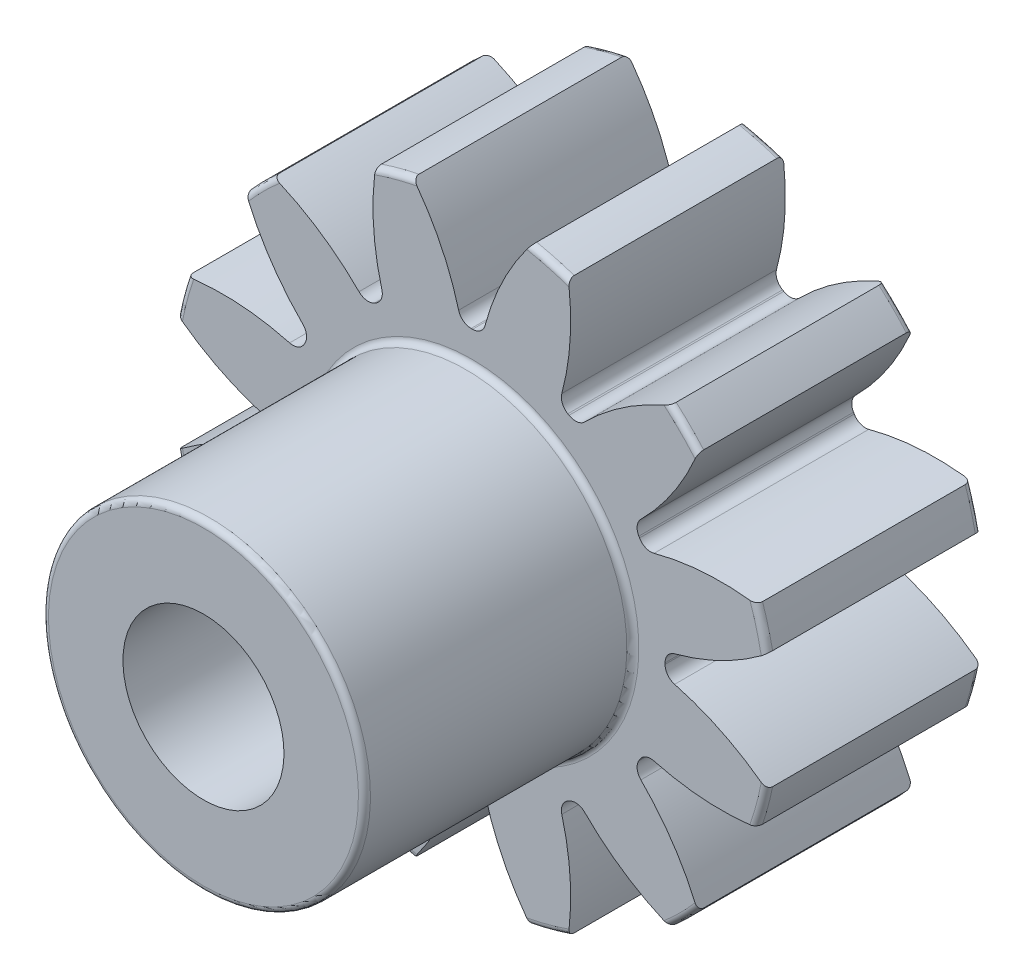
from build123d import *

# Parameters (mm, degrees)
FILLET2_R          = 0.11200000000000004
CUT_EXTRUDE2_DEPTH = 10.365895752142452
CIRPATTERN1_COUNT  = 12


with BuildPart() as part:
    # Sketch4 → Revolve1 (revolve)
    with BuildSketch(Plane(origin=(0, 0, 0), x_dir=(0, 0, -1), z_dir=(1, 0, 0))):
        Polygon((-9, 1.5000000000000002), (-9, 3.0000000000000004), (-4.000000000000001, 3.0000000000000004), (-4, 5.6), (0, 5.6), (0, 1.5000000000000002), align=None)
    revolve(axis=Axis((0, 2.4e-16, 4), (0, -1.2e-16, 1)))

    # Fillet2
    fillet2_edges = [part.edges().sort_by_distance(p)[0] for p in [
        (-6.9e-16, -5.599999999999998, -1.57e-15),
        (-6.9e-16, -5.6, 3.9999999999999982),
        (-3.7e-16, -2.9999999999999996, 4.000000000000001),
        (9.6e-16, -3.0000000000000013, 9),
    ]]
    fillet(fillet2_edges, radius=FILLET2_R)

    # Sketch7 → Cut-Extrude2 (cut, through all)
    with BuildSketch(Plane.XY.offset(4)):
        with BuildLine():
            ThreePointArc((-0.01314678239835454, 3.5999759946578216), (2.2e-16, 3.6), (0.01314678239835454, 3.5999759946578216))
            ThreePointArc((0.01314678239835454, 3.5999759946578216), (0.1599258315331567, 3.649411599421129), (0.24595148326272584, 3.778204283715438))
            ThreePointArc((0.24595148326272584, 3.778204283715438), (0.5852046767641852, 4.677684955882625), (1.0968941102712086, 5.491522858993883))
            ThreePointArc((1.0968941102712086, 5.491522858993883), (3.4e-16, 5.600000000000001), (-1.0968941102712086, 5.491522858993883))
            ThreePointArc((-1.0968941102712086, 5.491522858993883), (-0.5852046767641843, 4.677684955882624), (-0.24595148326272584, 3.778204283715438))
            ThreePointArc((-0.24595148326272584, 3.778204283715438), (-0.1599258315331567, 3.649411599421129), (-0.01314678239835454, 3.5999759946578216))
        make_face()
    cut_extrude2 = extrude(amount=-CUT_EXTRUDE2_DEPTH, mode=Mode.SUBTRACT)

    # CirPattern1: Cut-Extrude2 ×12 about axis
    cirpattern1_axis = Axis((1.48e-15, -4e-17, 0), (0, 0, 1))
    for i in range(1, CIRPATTERN1_COUNT):
        add(cut_extrude2.rotate(cirpattern1_axis, i * 360 / CIRPATTERN1_COUNT), mode=Mode.SUBTRACT)


solid = part.part
